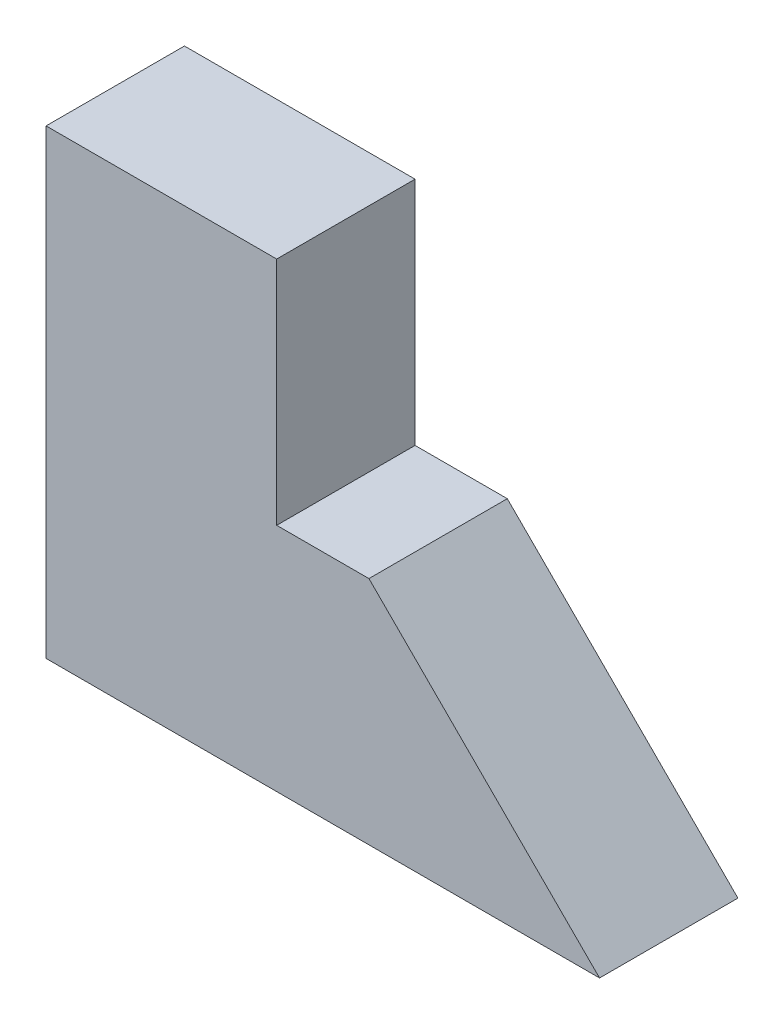
from build123d import *

# Parameters (mm, degrees)
EXTRUDE_1_DEPTH = 3


with BuildPart() as part:
    # 草图1 → 凸台-拉伸1 (new body)
    with BuildSketch(Plane.XY):
        Polygon((0, 0), (2, 0), (7, -5), (-5, -5), (-5, 5), (0, 5), align=None)
    extrude(amount=EXTRUDE_1_DEPTH)


solid = part.part
